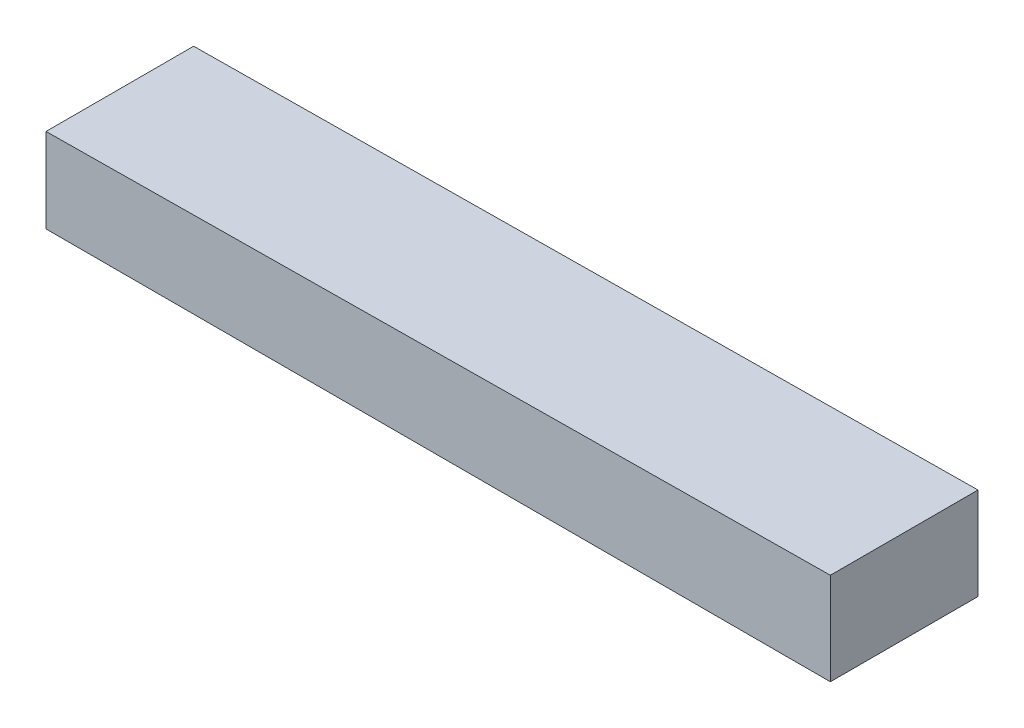
from build123d import *

# Parameters (mm, degrees)
BOSS_EXTRUDE1_DEPTH = 16


with BuildPart() as part:
    # Sketch1 → Boss-Extrude1 (new body)
    with BuildSketch(Plane.XY):
        Polygon((0, 0), (-85, 0), (-85, 9.15), (0, 10), align=None)
    extrude(amount=BOSS_EXTRUDE1_DEPTH)


solid = part.part
